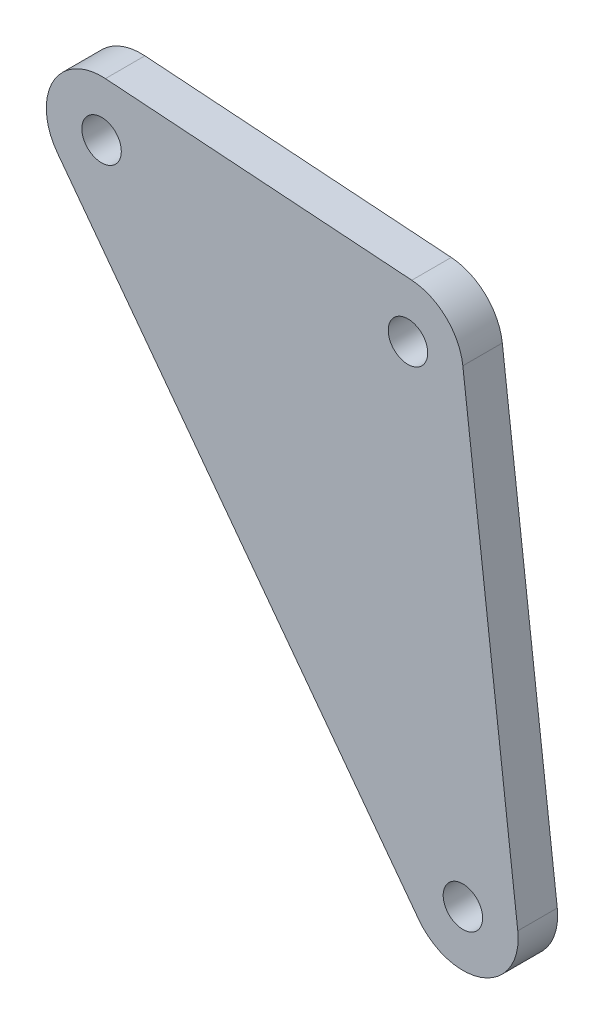
from build123d import *

# Parameters (mm, degrees)
SKETCH1_R           = 3.175
BOSS_EXTRUDE1_DEPTH = 6.35
FILLET1_R           = 8.89


with BuildPart() as part:
    # Sketch1 → Boss-Extrude1 (new body)
    with BuildSketch(Plane.XY):
        Polygon((-26.572670207, -20.693163298), (49.414762795, -26.00204572), (63.045667666, -140.545952681), align=None)
        with Locations((-7.829487562, -30.914331115)):
            Circle(SKETCH1_R, mode=Mode.SUBTRACT)
        with Locations((41.456372883, -34.357700996)):
            Circle(SKETCH1_R, mode=Mode.SUBTRACT)
        with Locations((50.297451581, -108.651499199)):
            Circle(SKETCH1_R, mode=Mode.SUBTRACT)
    extrude(amount=BOSS_EXTRUDE1_DEPTH)

    # Fillet1
    fillet1_edges = [part.edges().sort_by_distance(p)[0] for p in [
        (-26.572670207, -20.693163298, 3.175),
        (49.414762795, -26.00204572, 3.175),
        (63.045667666, -140.545952681, 3.175),
    ]]
    fillet(fillet1_edges, radius=FILLET1_R)


solid = part.part
